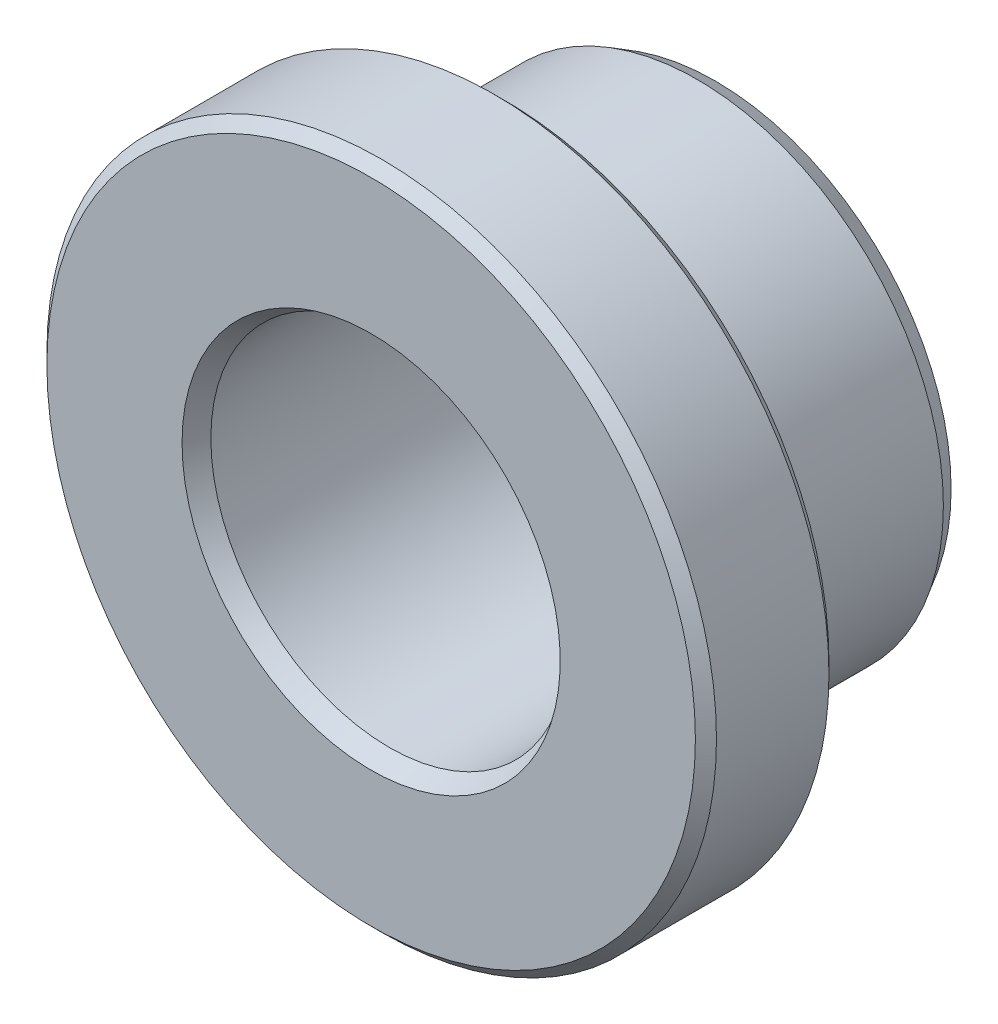
from build123d import *
from OCP.BRepFilletAPI import BRepFilletAPI_MakeChamfer

# Parameters (mm, degrees)
CHAMFER1_SIZE  = 0.75
CHAMFER1_SIZE2 = 1.299038106
CHAMFER2_SIZE  = 0.75


with BuildPart() as part:
    # Sketch1 → Revolve1 (revolve)
    with BuildSketch(Plane(origin=(0, 0, 0), x_dir=(0, 0, -1), z_dir=(1, 0, 0))):
        Polygon((0, 23.8125), (9.5, 23.8125), (9.5, 17.5), (24.5, 17.5), (24.5, 12.7), (0, 12.7), align=None)
    revolve(axis=Axis((0, 0, 0), (0, 0, -1)))

    # Chamfer1: one chamfer whose edges measure the first distance from different faces: ONE call of the kernel's chamfer builder (chamfer() names one face for all edges)
    chamfer1_edges_1 = [part.edges().sort_by_distance(p)[0] for p in [
        (0, -17.5, -24.5),
        (0, -12.7, -24.5),
    ]]
    chamfer1_side_1 = [part.faces().sort_by_distance(p)[0] for p in [
        (0, -17.005025253, -24.5),
    ]]
    chamfer1_edges_2 = [part.edges().sort_by_distance(p)[0] for p in [
        (0, -12.7, 0),
    ]]
    chamfer1_side_2 = [part.faces().sort_by_distance(p)[0] for p in [
        (0, -13.373519209, 0),
    ]]
    chamfer1 = BRepFilletAPI_MakeChamfer(part.part.solid().wrapped)
    for e in chamfer1_edges_1:
        chamfer1.Add(CHAMFER1_SIZE, CHAMFER1_SIZE2, e.wrapped, chamfer1_side_1[0].wrapped)  # the first distance lies on this face
    for e in chamfer1_edges_2:
        chamfer1.Add(CHAMFER1_SIZE, CHAMFER1_SIZE2, e.wrapped, chamfer1_side_2[0].wrapped)  # the first distance lies on this face
    add(Compound.cast(chamfer1.Shape()), mode=Mode.REPLACE)

    # Chamfer2
    chamfer2_edges = [part.edges().sort_by_distance(p)[0] for p in [
        (0, -23.8125, -9.5),
        (0, -23.8125, 0),
    ]]
    chamfer(chamfer2_edges, length=CHAMFER2_SIZE)


solid = part.part
